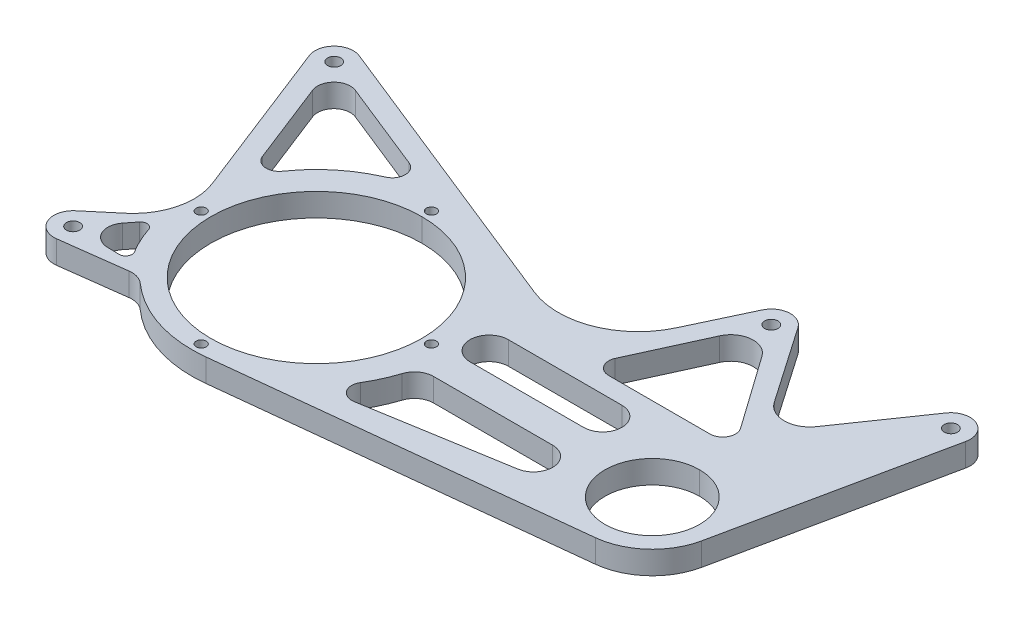
from build123d import *

# Parameters (mm, degrees)
SKETCH1_R             = 52.3875
SKETCH1_R_2           = 23.5
BOSS_EXTRUDE1_DEPTH   = 5.715
M6_CLEARANCE_HOLE1_D  = 6.6
F_5_0MM_DOWEL_HOLE1_D = 5
CIRPATTERN1_COUNT     = 4
CUT_EXTRUDE1_DEPTH    = 284.979078357
CUT_EXTRUDE2_DEPTH    = 284.979078357


with BuildPart() as part:
    # Sketch1 → Boss-Extrude1 (new, symmetric)
    with BuildSketch(Plane(origin=(0, 0, 0), x_dir=(1, 0, 0), z_dir=(0, 1, 0))):
        with BuildLine():
            Line((-207.974881785, -9.956762437), (-62.780706514, -68.14502812))
            ThreePointArc((-62.780706514, -68.14502812), (-33.518744337, -68.231765471), (-12.176603989, -48.212200061))
            Line((-12.176603989, -48.212200061), (1.412558245, -19.284326264))
            ThreePointArc((1.412558245, -19.284326264), (9.247910088, -13.841666007), (17.871565555, -17.92184438))
            Line((17.871565555, -17.92184438), (44.159519082, -55.990558325))
            ThreePointArc((44.159519082, -55.990558325), (54.61, -61.474087679), (65.060480918, -55.990558325))
            Line((65.060480918, -55.990558325), (91.348434445, -17.92184438))
            ThreePointArc((91.348434445, -17.92184438), (102.948934458, -14.583873353), (108.5062916, -25.299722957))
            Line((108.5062916, -25.299722957), (85.67665489, -133.551751975))
            ThreePointArc((85.67665489, -133.551751975), (75.916532775, -150.539204768), (58.043657912, -158.563784522))
            Line((58.043657912, -158.563784522), (-116.494367072, -177.55085719))
            ThreePointArc((-116.494367072, -177.55085719), (-142.092740129, -174.957766874), (-164.426538493, -162.182702446))
            ThreePointArc((-164.426538493, -162.182702446), (-168.164823601, -160.06920649), (-172.443362527, -159.700770109))
            Line((-172.443362527, -159.700770109), (-204.355245166, -163.82191268))
            ThreePointArc((-204.355245166, -163.82191268), (-214.295764489, -158.206433226), (-211.707233022, -147.086764223))
            Line((-211.707233022, -147.086764223), (-198.151371623, -135.681934472))
            ThreePointArc((-198.151371623, -135.681934472), (-188.283833694, -119.954004575), (-189.430137427, -101.422354045))
            Line((-189.430137427, -101.422354045), (-220.388836369, -22.267635732))
            ThreePointArc((-220.388836369, -22.267635732), (-218.225236723, -12.034965467), (-207.974881785, -9.956762437))
        make_face()
        with Locations(Location((-123.19, -116.001477372, 0), (0, 0, 270))):
            Circle(SKETCH1_R, mode=Mode.SUBTRACT)
        with Locations(Location((54.61, -127, 0), (0, 0, 270))):
            Circle(SKETCH1_R_2, mode=Mode.SUBTRACT)
    extrude(amount=BOSS_EXTRUDE1_DEPTH, both=True)

    # M6 Clearance Hole1 (through all)
    with Locations(Plane(origin=(0, -5.715, 0), x_dir=(-1, 0, 0), z_dir=(0, -1, 0))):
        with Locations((-10.033704867, -23.334197365), (211.518182886, -18.798178744), (205.575185514, -154.375359311), (-99.186295133, -23.334197365)):
            Hole(M6_CLEARANCE_HOLE1_D / 2)

    # Ø5.0mm Dowel Hole1 (through all)
    with Locations(Plane(origin=(0, -5.715, 0), x_dir=(-1, 0, 0), z_dir=(0, -1, 0))):
        with Locations((123.19, -173.151477372)):
            f_5_0mm_dowel_hole1 = Hole(F_5_0MM_DOWEL_HOLE1_D / 2)

    # CirPattern1: Ø5.0mm Dowel Hole1 ×4 about axis
    cirpattern1_axis = Axis((-123.19, 0, 116.001477372), (0, 1, 0))
    for i in range(1, CIRPATTERN1_COUNT):
        add(f_5_0mm_dowel_hole1.rotate(cirpattern1_axis, i * 360 / CIRPATTERN1_COUNT), mode=Mode.SUBTRACT)

    # Sketch6 → Cut-Extrude1 (cut, through all)
    with BuildSketch(Plane.XZ.offset(5.715)):
        with BuildLine():
            ThreePointArc((-14.234653979, 76.580666612), (-13.797169823, 82.649279585), (-8.456504121, 85.564197365))
            Line((-8.456504121, 85.564197365), (41.801580719, 85.564197365))
            ThreePointArc((41.801580719, 85.564197365), (47.441443369, 82.132150292), (46.984841737, 75.545913676))
            Line((46.984841737, 75.545913676), (21.201297863, 39.113933708))
            ThreePointArc((21.201297863, 39.113933708), (11.084872861, 34.469497273), (2.016277078, 40.924992231))
            Line((2.016277078, 40.924992231), (-14.234653979, 76.580666612))
        make_face()
        with BuildLine():
            ThreePointArc((-188.626913597, 77.326218823), (-183.343464985, 81.400582198), (-177.265672517, 78.648182362))
            ThreePointArc((-177.265672517, 78.648182362), (-164.864290964, 65.181201114), (-149.229324423, 55.657458697))
            ThreePointArc((-149.229324423, 55.657458697), (-145.319075006, 49.625624375), (-149.386073966, 43.698348841))
            Line((-149.386073966, 43.698348841), (-194.042740287, 25.801666969))
            ThreePointArc((-194.042740287, 25.801666969), (-202.810079512, 27.579196728), (-204.660650751, 36.331409888))
            Line((-204.660650751, 36.331409888), (-188.626913597, 77.326218823))
        make_face()
        with BuildLine():
            ThreePointArc((-194.692687992, 140.689511725), (-195.773357295, 149.809803058), (-188.096484537, 154.850952212))
            Line((-188.096484537, 154.850952212), (-182.142551509, 155.01295786))
            ThreePointArc((-182.142551509, 155.01295786), (-179.298484939, 153.425933155), (-179.332786017, 150.169219243))
            ThreePointArc((-179.332786017, 150.169219243), (-182.766707481, 143.751485155), (-185.46990532, 136.993390091))
            ThreePointArc((-185.46990532, 136.993390091), (-187.940827525, 134.871620657), (-190.985681304, 136.027573744))
            Line((-190.985681304, 136.027573744), (-194.692687992, 140.689511725))
        make_face()
    extrude(amount=-CUT_EXTRUDE1_DEPTH, mode=Mode.SUBTRACT)

    # Sketch7 → Cut-Extrude2 (cut, through all)
    with BuildSketch(Plane.XZ.offset(5.715)):
        with BuildLine():
            Line((-48.815667356, 114.096477372), (7.572332644, 114.096477372))
            ThreePointArc((7.572332644, 114.096477372), (17.097332644, 104.571477372), (7.572332644, 95.046477372))
            Line((7.572332644, 95.046477372), (-48.815667356, 95.046477372))
            ThreePointArc((-48.815667356, 95.046477372), (-58.340667356, 104.571477372), (-48.815667356, 114.096477372))
        make_face()
        with BuildLine():
            Line((-60.480063265, 159.980626251), (9.143311078, 148.338049571))
            ThreePointArc((9.143311078, 148.338049571), (17.064665217, 138.155302762), (7.572332644, 129.418495204))
            Line((7.572332644, 129.418495204), (-51.525154545, 129.418495204))
            ThreePointArc((-51.525154545, 129.418495204), (-57.140513894, 131.249772802), (-60.59665397, 136.039442314))
            ThreePointArc((-60.59665397, 136.039442314), (-63.415414116, 143.322639291), (-67.078188304, 150.220062883))
            ThreePointArc((-67.078188304, 150.220062883), (-66.914295931, 157.219714512), (-60.480063265, 159.980626251))
        make_face()
    extrude(amount=-CUT_EXTRUDE2_DEPTH, mode=Mode.SUBTRACT)


solid = part.part
